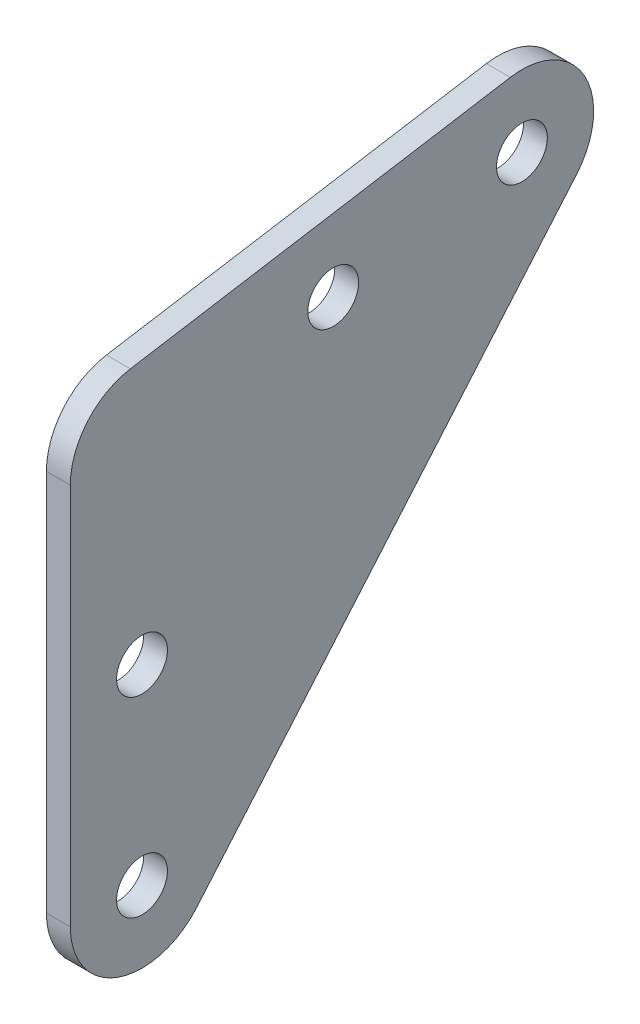
from build123d import *

# Parameters (mm, degrees)
BOSS_EXTRUDE1_START     = 92.868812
BOSS_EXTRUDE1_DEPTH     = 3.175
FILLET1_R               = 9.525
F_1_4_CLEARANCE_HOLE1_D = 6.7564


with BuildPart() as part:
    # Sketch1 → Boss-Extrude1 (new body)
    with BuildSketch(Plane(origin=(0, 0, 0), x_dir=(0, 0, -1), z_dir=(1, 0, 0)).offset(BOSS_EXTRUDE1_START)):
        with BuildLine():
            Line((-1304.620022056, 323.577914146), (-1279.556254241, 327.697081886))
            ThreePointArc((-1279.556254241, 327.697081886), (-1269.714759772, 322.976697122), (-1270.768280058, 312.11266745))
            Line((-1270.768280058, 312.11266745), (-1321.232047874, 253.01907305))
            ThreePointArc((-1321.232047874, 253.01907305), (-1331.771796135, 250.268190307), (-1338.000334154, 259.204574554))
            Line((-1338.000334154, 259.204574554), (-1338.000334154, 284.604574554))
            Line((-1338.000334154, 284.604574554), (-1338.000334154, 318.091943092))
            Line((-1338.000334154, 318.091943092), (-1304.620022056, 323.577914146))
        make_face()
    extrude(amount=BOSS_EXTRUDE1_DEPTH)

    # Fillet1
    fillet1_edges = [part.edges().sort_by_distance(p)[0] for p in [
        (94.456312, 318.091943092, 1338.000334154),
    ]]
    fillet(fillet1_edges, radius=FILLET1_R)

    # 1/4 Clearance Hole1 (through all)
    with Locations(Plane(origin=(96.043812484, 0, 0), x_dir=(0, 0, -1), z_dir=(1, 0, 0))):
        with Locations((-1303.075334154, 314.179001215), (-1278.011566338, 318.298168955), (-1328.475334154, 284.604574554), (-1328.475334154, 259.204574554)):
            Hole(F_1_4_CLEARANCE_HOLE1_D / 2)


solid = part.part
